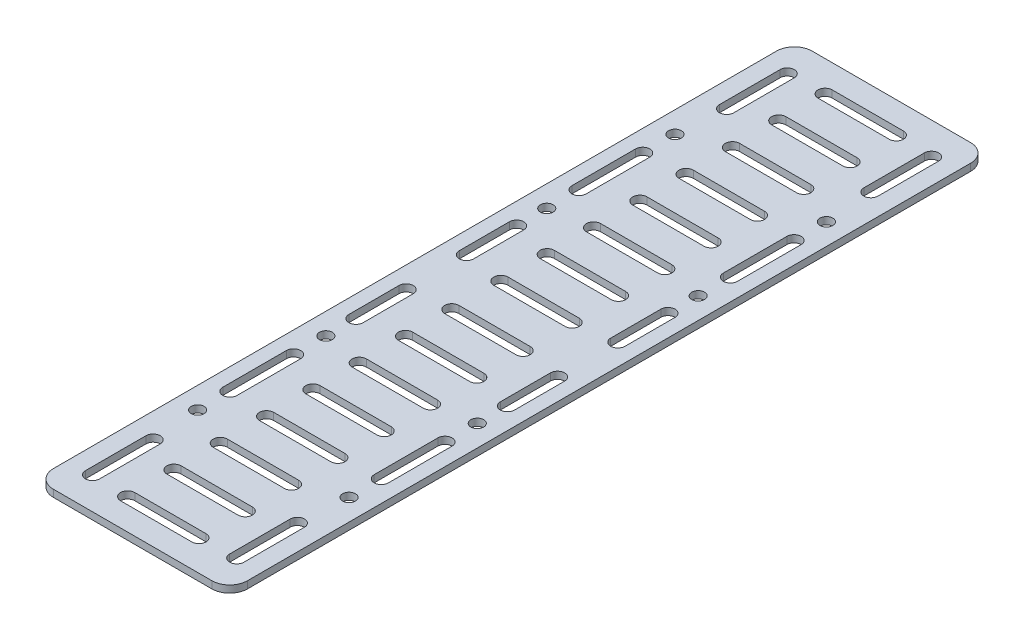
from build123d import *

# Parameters (mm, degrees)
SKETCH1_W            = 54.5
SKETCH1_H            = 213
BOSS_EXTRUDE1_DEPTH  = 2
M3_CLEARANCE_HOLE1_D = 3.6
CUT_EXTRUDE1_DEPTH   = 110.949135968
FILLET1_R            = 5


with BuildPart() as part:
    # Sketch1 → Boss-Extrude1 (new body)
    with BuildSketch(Plane(origin=(0, 0, 0), x_dir=(1, 0, 0), z_dir=(0, 1, 0))):
        Rectangle(SKETCH1_W, SKETCH1_H)
    extrude(amount=BOSS_EXTRUDE1_DEPTH)

    # M3 Clearance Hole1 (through all)
    with Locations(Plane(origin=(0, 2, 0), x_dir=(1, 0, 0), z_dir=(0, 1, 0))):
        with Locations((-21.25, 67), (-21.25, 31), (21.25, 67), (21.25, 31), (21.25, -31), (21.25, -67), (-21.25, -67), (-21.25, -31)):
            Hole(M3_CLEARANCE_HOLE1_D / 2)

    # Sketch5 → Cut-Extrude1 (cut, through all)
    with BuildSketch(Plane(origin=(0, 2, 0), x_dir=(1, 0, 0), z_dir=(0, 1, 0))):
        with BuildLine():
            Line((-18.25, 97.5), (-18.25, 80.5))
            ThreePointArc((-18.25, 80.5), (-20.25, 78.5), (-22.25, 80.5))
            Line((-22.25, 80.5), (-22.25, 97.5))
            ThreePointArc((-22.25, 97.5), (-20.25, 99.5), (-18.25, 97.5))
        make_face()
        with BuildLine():
            Line((18.25, 97.5), (18.25, 80.5))
            ThreePointArc((18.25, 80.5), (20.25, 78.5), (22.25, 80.5))
            Line((22.25, 80.5), (22.25, 97.5))
            ThreePointArc((22.25, 97.5), (20.25, 99.5), (18.25, 97.5))
        make_face()
        with BuildLine():
            Line((-10, 99.885191349), (10, 99.885191349))
            ThreePointArc((10, 99.885191349), (12, 97.885191349), (10, 95.885191349))
            Line((10, 95.885191349), (-10, 95.885191349))
            ThreePointArc((-10, 95.885191349), (-12, 97.885191349), (-10, 99.885191349))
        make_face()
        with BuildLine():
            Line((-10, 86.885191349), (10, 86.885191349))
            ThreePointArc((10, 86.885191349), (12, 84.885191349), (10, 82.885191349))
            Line((10, 82.885191349), (-10, 82.885191349))
            ThreePointArc((-10, 82.885191349), (-12, 84.885191349), (-10, 86.885191349))
        make_face()
        with BuildLine():
            Line((-10, 73.885191349), (10, 73.885191349))
            ThreePointArc((10, 73.885191349), (12, 71.885191349), (10, 69.885191349))
            Line((10, 69.885191349), (-10, 69.885191349))
            ThreePointArc((-10, 69.885191349), (-12, 71.885191349), (-10, 73.885191349))
        make_face()
        with BuildLine():
            Line((-10, 60.885191349), (10, 60.885191349))
            ThreePointArc((10, 60.885191349), (12, 58.885191349), (10, 56.885191349))
            Line((10, 56.885191349), (-10, 56.885191349))
            ThreePointArc((-10, 56.885191349), (-12, 58.885191349), (-10, 60.885191349))
        make_face()
        with BuildLine():
            Line((-10, 47.885191349), (10, 47.885191349))
            ThreePointArc((10, 47.885191349), (12, 45.885191349), (10, 43.885191349))
            Line((10, 43.885191349), (-10, 43.885191349))
            ThreePointArc((-10, 43.885191349), (-12, 45.885191349), (-10, 47.885191349))
        make_face()
        with BuildLine():
            Line((-10, 34.885191349), (10, 34.885191349))
            ThreePointArc((10, 34.885191349), (12, 32.885191349), (10, 30.885191349))
            Line((10, 30.885191349), (-10, 30.885191349))
            ThreePointArc((-10, 30.885191349), (-12, 32.885191349), (-10, 34.885191349))
        make_face()
        with BuildLine():
            Line((-10, 21.885191349), (10, 21.885191349))
            ThreePointArc((10, 21.885191349), (12, 19.885191349), (10, 17.885191349))
            Line((10, 17.885191349), (-10, 17.885191349))
            ThreePointArc((-10, 17.885191349), (-12, 19.885191349), (-10, 21.885191349))
        make_face()
        with BuildLine():
            Line((-10, 8.885191349), (10, 8.885191349))
            ThreePointArc((10, 8.885191349), (12, 6.885191349), (10, 4.885191349))
            Line((10, 4.885191349), (-10, 4.885191349))
            ThreePointArc((-10, 4.885191349), (-12, 6.885191349), (-10, 8.885191349))
        make_face()
        with BuildLine():
            Line((-19.25, 57.932734115), (-19.25, 40.067265885))
            ThreePointArc((-19.25, 40.067265885), (-21.25, 38.067265885), (-23.25, 40.067265885))
            Line((-23.25, 40.067265885), (-23.25, 57.932734115))
            ThreePointArc((-23.25, 57.932734115), (-21.25, 59.932734115), (-19.25, 57.932734115))
        make_face()
        with BuildLine():
            Line((-19.25, 22.533690779), (-19.25, 8.466309221))
            ThreePointArc((-19.25, 8.466309221), (-21.25, 6.466309221), (-23.25, 8.466309221))
            Line((-23.25, 8.466309221), (-23.25, 22.533690779))
            ThreePointArc((-23.25, 22.533690779), (-21.25, 24.533690779), (-19.25, 22.533690779))
        make_face()
        with BuildLine():
            Line((19.25, 57.932734115), (19.25, 40.067265885))
            ThreePointArc((19.25, 40.067265885), (21.25, 38.067265885), (23.25, 40.067265885))
            Line((23.25, 40.067265885), (23.25, 57.932734115))
            ThreePointArc((23.25, 57.932734115), (21.25, 59.932734115), (19.25, 57.932734115))
        make_face()
        with BuildLine():
            Line((19.25, 22.533690779), (19.25, 8.466309221))
            ThreePointArc((19.25, 8.466309221), (21.25, 6.466309221), (23.25, 8.466309221))
            Line((23.25, 8.466309221), (23.25, 22.533690779))
            ThreePointArc((23.25, 22.533690779), (21.25, 24.533690779), (19.25, 22.533690779))
        make_face()
        with BuildLine():
            Line((-18.25, -97.5), (-18.25, -80.5))
            ThreePointArc((-18.25, -80.5), (-20.25, -78.5), (-22.25, -80.5))
            Line((-22.25, -80.5), (-22.25, -97.5))
            ThreePointArc((-22.25, -97.5), (-20.25, -99.5), (-18.25, -97.5))
        make_face()
        with BuildLine():
            Line((18.25, -97.5), (18.25, -80.5))
            ThreePointArc((18.25, -80.5), (20.25, -78.5), (22.25, -80.5))
            Line((22.25, -80.5), (22.25, -97.5))
            ThreePointArc((22.25, -97.5), (20.25, -99.5), (18.25, -97.5))
        make_face()
        with BuildLine():
            Line((-10, -99.885191349), (10, -99.885191349))
            ThreePointArc((10, -99.885191349), (12, -97.885191349), (10, -95.885191349))
            Line((10, -95.885191349), (-10, -95.885191349))
            ThreePointArc((-10, -95.885191349), (-12, -97.885191349), (-10, -99.885191349))
        make_face()
        with BuildLine():
            Line((-10, -86.885191349), (10, -86.885191349))
            ThreePointArc((10, -86.885191349), (12, -84.885191349), (10, -82.885191349))
            Line((10, -82.885191349), (-10, -82.885191349))
            ThreePointArc((-10, -82.885191349), (-12, -84.885191349), (-10, -86.885191349))
        make_face()
        with BuildLine():
            Line((-10, -73.885191349), (10, -73.885191349))
            ThreePointArc((10, -73.885191349), (12, -71.885191349), (10, -69.885191349))
            Line((10, -69.885191349), (-10, -69.885191349))
            ThreePointArc((-10, -69.885191349), (-12, -71.885191349), (-10, -73.885191349))
        make_face()
        with BuildLine():
            Line((-10, -60.885191349), (10, -60.885191349))
            ThreePointArc((10, -60.885191349), (12, -58.885191349), (10, -56.885191349))
            Line((10, -56.885191349), (-10, -56.885191349))
            ThreePointArc((-10, -56.885191349), (-12, -58.885191349), (-10, -60.885191349))
        make_face()
        with BuildLine():
            Line((-10, -47.885191349), (10, -47.885191349))
            ThreePointArc((10, -47.885191349), (12, -45.885191349), (10, -43.885191349))
            Line((10, -43.885191349), (-10, -43.885191349))
            ThreePointArc((-10, -43.885191349), (-12, -45.885191349), (-10, -47.885191349))
        make_face()
        with BuildLine():
            Line((-10, -34.885191349), (10, -34.885191349))
            ThreePointArc((10, -34.885191349), (12, -32.885191349), (10, -30.885191349))
            Line((10, -30.885191349), (-10, -30.885191349))
            ThreePointArc((-10, -30.885191349), (-12, -32.885191349), (-10, -34.885191349))
        make_face()
        with BuildLine():
            Line((-10, -21.885191349), (10, -21.885191349))
            ThreePointArc((10, -21.885191349), (12, -19.885191349), (10, -17.885191349))
            Line((10, -17.885191349), (-10, -17.885191349))
            ThreePointArc((-10, -17.885191349), (-12, -19.885191349), (-10, -21.885191349))
        make_face()
        with BuildLine():
            Line((-10, -8.885191349), (10, -8.885191349))
            ThreePointArc((10, -8.885191349), (12, -6.885191349), (10, -4.885191349))
            Line((10, -4.885191349), (-10, -4.885191349))
            ThreePointArc((-10, -4.885191349), (-12, -6.885191349), (-10, -8.885191349))
        make_face()
        with BuildLine():
            Line((-19.25, -57.932734115), (-19.25, -40.067265885))
            ThreePointArc((-19.25, -40.067265885), (-21.25, -38.067265885), (-23.25, -40.067265885))
            Line((-23.25, -40.067265885), (-23.25, -57.932734115))
            ThreePointArc((-23.25, -57.932734115), (-21.25, -59.932734115), (-19.25, -57.932734115))
        make_face()
        with BuildLine():
            Line((-19.25, -22.533690779), (-19.25, -8.466309221))
            ThreePointArc((-19.25, -8.466309221), (-21.25, -6.466309221), (-23.25, -8.466309221))
            Line((-23.25, -8.466309221), (-23.25, -22.533690779))
            ThreePointArc((-23.25, -22.533690779), (-21.25, -24.533690779), (-19.25, -22.533690779))
        make_face()
        with BuildLine():
            Line((19.25, -57.932734115), (19.25, -40.067265885))
            ThreePointArc((19.25, -40.067265885), (21.25, -38.067265885), (23.25, -40.067265885))
            Line((23.25, -40.067265885), (23.25, -57.932734115))
            ThreePointArc((23.25, -57.932734115), (21.25, -59.932734115), (19.25, -57.932734115))
        make_face()
        with BuildLine():
            Line((19.25, -22.533690779), (19.25, -8.466309221))
            ThreePointArc((19.25, -8.466309221), (21.25, -6.466309221), (23.25, -8.466309221))
            Line((23.25, -8.466309221), (23.25, -22.533690779))
            ThreePointArc((23.25, -22.533690779), (21.25, -24.533690779), (19.25, -22.533690779))
        make_face()
    extrude(amount=-CUT_EXTRUDE1_DEPTH, mode=Mode.SUBTRACT)

    # Fillet1
    fillet1_edges = [part.edges().sort_by_distance(p)[0] for p in [
        (27.25, 1, 106.5),
        (-27.25, 1, 106.5),
        (-27.25, 1, -106.5),
        (27.25, 1, -106.5),
    ]]
    fillet(fillet1_edges, radius=FILLET1_R)


solid = part.part
